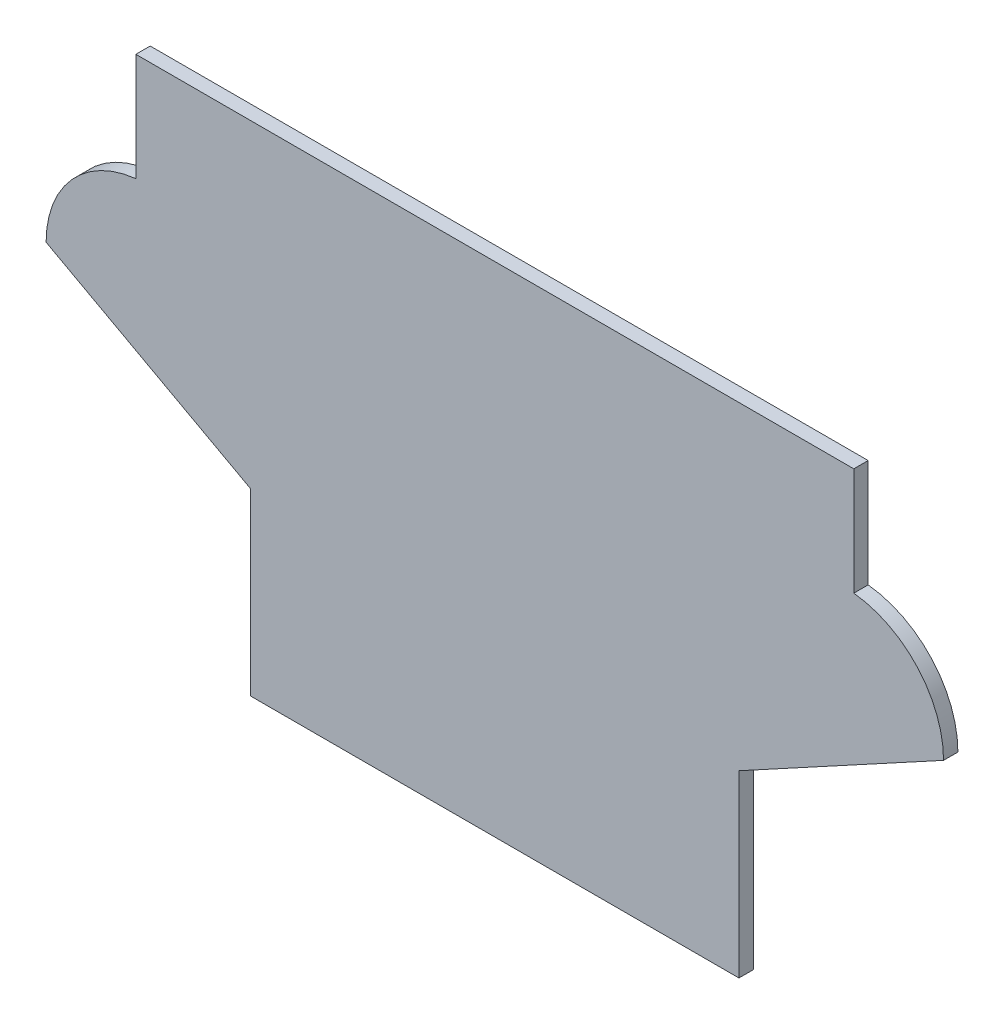
from build123d import *

# Parameters (mm, degrees)
BOSS_EXTRUDE1_DEPTH = 20


with BuildPart() as part:
    # Sketch1 → Boss-Extrude1 (new body)
    with BuildSketch(Plane.XY):
        with BuildLine():
            Line((-625, 405), (-340, 250))
            Line((-340, 250), (-340, 0))
            Line((-340, 0), (340, 0))
            Line((340, 0), (340, 250))
            Line((340, 250), (625, 405))
            ThreePointArc((625, 405), (589.16333328, 498.541434669), (500, 544.194109071))
            Line((500, 544.194109071), (500, 694.194109071))
            Line((500, 694.194109071), (-500, 694.194109071))
            Line((-500, 694.194109071), (-500, 544.194109071))
            ThreePointArc((-500, 544.194109071), (-589.16333328, 498.541434669), (-625, 405))
        make_face()
    extrude(amount=BOSS_EXTRUDE1_DEPTH)


solid = part.part
